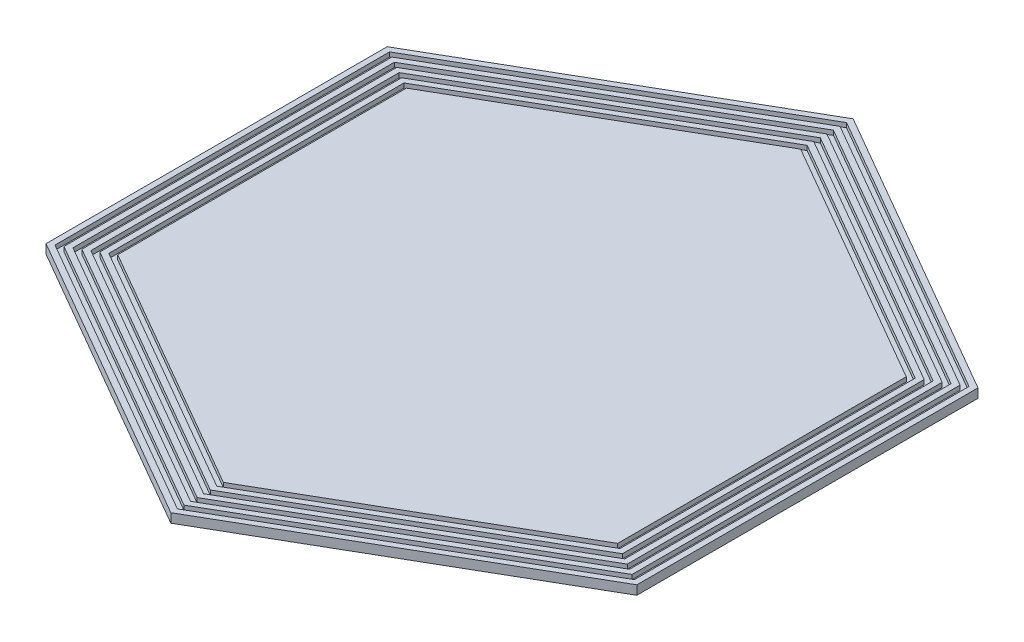
from build123d import *

# Parameters (mm, degrees)
BOSS_EXTRUDE1_DEPTH = 1.6
CUT_EXTRUDE1_DEPTH  = 0.8


with BuildPart() as part:
    # Sketch1 → Boss-Extrude1 (new body)
    with BuildSketch(Plane(origin=(0, 0, 0), x_dir=(1, 0, 0), z_dir=(0, 1, 0))):
        Polygon((0, -60), (51.961524227, -30), (51.961524227, 30), (0, 60), (-51.961524227, 30), (-51.961524227, -30), align=None)
    extrude(amount=BOSS_EXTRUDE1_DEPTH)

    # Sketch2 → Cut-Extrude1 (cut)
    # profile 1 of 4: a face of its own
    with BuildSketch(Plane(origin=(0, 1.6, 0), x_dir=(1, 0, 0), z_dir=(0, 1, 0))):
        Polygon((0, 58.845299462), (-50.961524227, 29.422649731), (-50.961524227, -29.422649731), (0, -58.845299462), (50.961524227, -29.422649731), (50.961524227, 29.422649731), align=None)
        Polygon((-49.961524227, 28.845299462), (-49.961524227, -28.845299462), (0, -57.690598923), (49.961524227, -28.845299462), (49.961524227, 28.845299462), (0, 57.690598923), align=None, mode=Mode.SUBTRACT)
    # profile 2 of 4: a face of its own
    with BuildSketch(Plane(origin=(0, 1.6, 0), x_dir=(1, 0, 0), z_dir=(0, 1, 0))):
        Polygon((0, 56.535898385), (-48.961524227, 28.267949192), (-48.961524227, -28.267949192), (0, -56.535898385), (48.961524227, -28.267949192), (48.961524227, 28.267949192), align=None)
        Polygon((-47.961524227, 27.690598923), (-47.961524227, -27.690598923), (0, -55.381197846), (47.961524227, -27.690598923), (47.961524227, 27.690598923), (0, 55.381197846), align=None, mode=Mode.SUBTRACT)
    # profile 3 of 4: a face of its own
    with BuildSketch(Plane(origin=(0, 1.6, 0), x_dir=(1, 0, 0), z_dir=(0, 1, 0))):
        Polygon((0, 54.226497308), (-46.961524227, 27.113248654), (-46.961524227, -27.113248654), (0, -54.226497308), (46.961524227, -27.113248654), (46.961524227, 27.113248654), align=None)
        Polygon((-45.961524227, 26.535898385), (-45.961524227, -26.535898385), (0, -53.07179677), (45.961524227, -26.535898385), (45.961524227, 26.535898385), (0, 53.07179677), align=None, mode=Mode.SUBTRACT)
    # profile 4 of 4: a face of its own
    with BuildSketch(Plane(origin=(0, 1.6, 0), x_dir=(1, 0, 0), z_dir=(0, 1, 0))):
        Polygon((0, 51.917096231), (-44.961524227, 25.958548116), (-44.961524227, -25.958548116), (0, -51.917096231), (44.961524227, -25.958548116), (44.961524227, 25.958548116), align=None)
        Polygon((-43.961524227, 25.381197846), (-43.961524227, -25.381197846), (0, -50.762395693), (43.961524227, -25.381197846), (43.961524227, 25.381197846), (0, 50.762395693), align=None, mode=Mode.SUBTRACT)
    extrude(amount=-CUT_EXTRUDE1_DEPTH, mode=Mode.SUBTRACT)


solid = part.part
